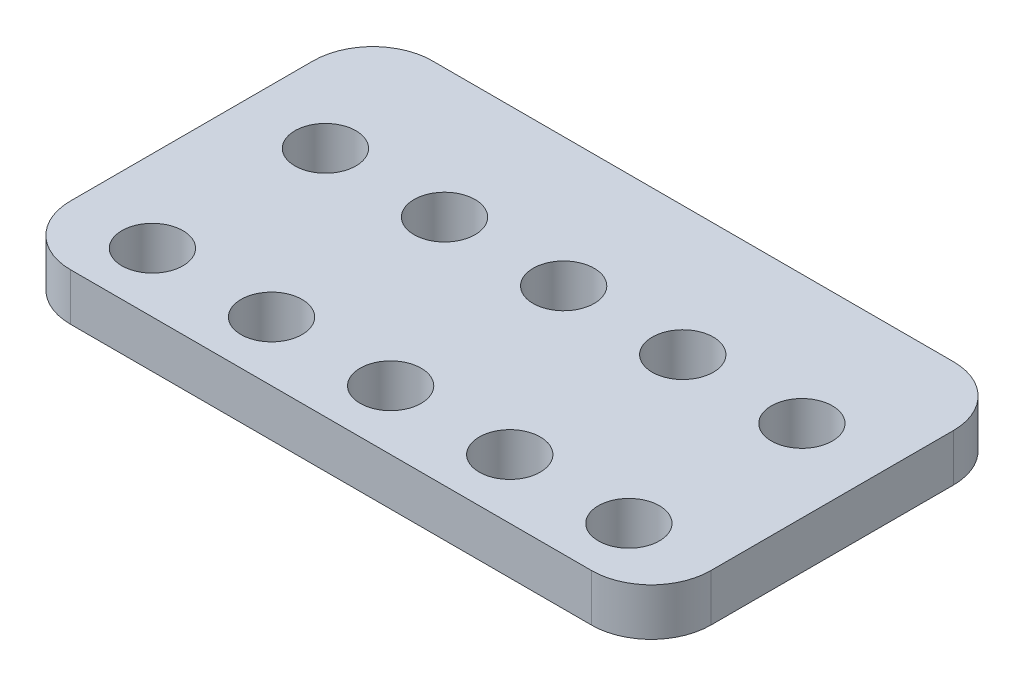
from build123d import *

# Parameters (mm, degrees)
SKETCH1_W           = 43
SKETCH1_H           = 24.3
SKETCH1_R           = 2.05
BOSS_EXTRUDE1_DEPTH = 3.175
FILLET1_R           = 4


with BuildPart() as part:
    # Sketch1 → Boss-Extrude1 (new body)
    with BuildSketch(Plane(origin=(0, 0, 0), x_dir=(1, 0, 0), z_dir=(0, 1, 0))):
        Rectangle(SKETCH1_W, SKETCH1_H)
        with Locations(Location((-16, -8.15, 0), (0, 0, 270))):
            Circle(SKETCH1_R, mode=Mode.SUBTRACT)
        with Locations(Location((-8, -8.15, 0), (0, 0, 270))):
            Circle(SKETCH1_R, mode=Mode.SUBTRACT)
        with Locations(Location((0, -8.15, 0), (0, 0, 270))):
            Circle(SKETCH1_R, mode=Mode.SUBTRACT)
        with Locations(Location((8, -8.15, 0), (0, 0, 270))):
            Circle(SKETCH1_R, mode=Mode.SUBTRACT)
        with Locations(Location((16, -8.15, 0), (0, 0, 270))):
            Circle(SKETCH1_R, mode=Mode.SUBTRACT)
        with Locations(Location((-16, 3.47, 0), (0, 0, 270))):
            Circle(SKETCH1_R, mode=Mode.SUBTRACT)
        with Locations(Location((-8, 3.47, 0), (0, 0, 270))):
            Circle(SKETCH1_R, mode=Mode.SUBTRACT)
        with Locations(Location((0, 3.47, 0), (0, 0, 270))):
            Circle(SKETCH1_R, mode=Mode.SUBTRACT)
        with Locations(Location((8, 3.47, 0), (0, 0, 270))):
            Circle(SKETCH1_R, mode=Mode.SUBTRACT)
        with Locations(Location((16, 3.47, 0), (0, 0, 270))):
            Circle(SKETCH1_R, mode=Mode.SUBTRACT)
    extrude(amount=BOSS_EXTRUDE1_DEPTH)

    # Fillet1
    fillet1_edges = [part.edges().sort_by_distance(p)[0] for p in [
        (-21.5, 1.5875, -12.15),
        (21.5, 1.5875, -12.15),
        (21.5, 1.5875, 12.15),
        (-21.5, 1.5875, 12.15),
    ]]
    fillet(fillet1_edges, radius=FILLET1_R)


solid = part.part
